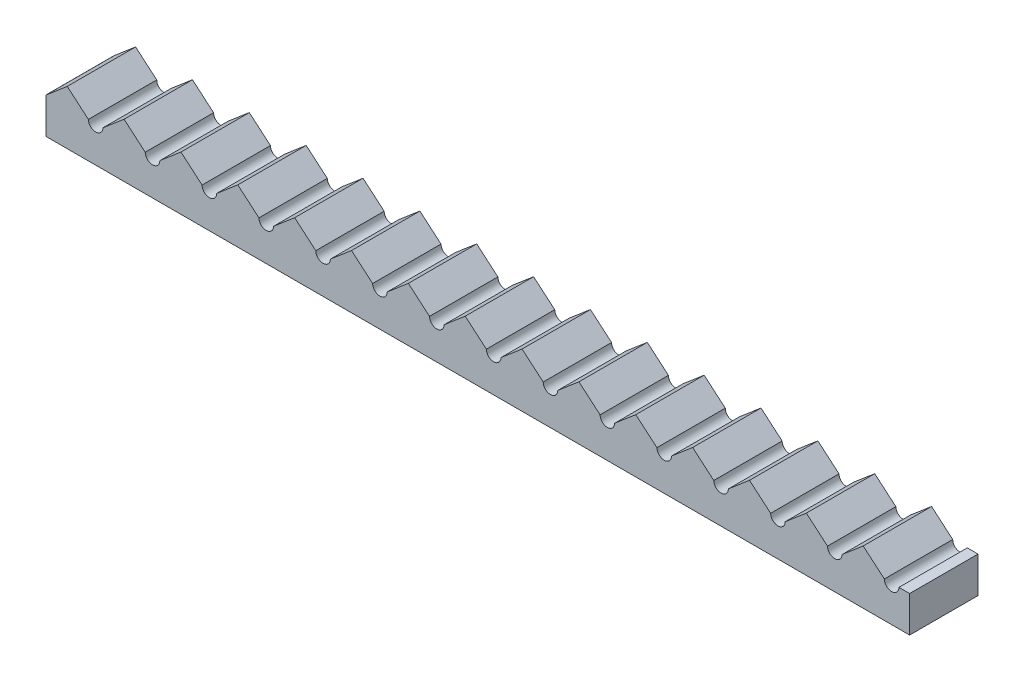
from build123d import *

# Parameters (mm, degrees)
SKETCH1_W           = 304.8
SKETCH1_H           = 12.7
BOSS_EXTRUDE1_DEPTH = 24.13
SKETCH3_R           = 2.57175
CUT_EXTRUDE1_DEPTH  = 39.624
BOSS_EXTRUDE2_DEPTH = 24.13


with BuildPart() as part:
    # Sketch1 → Boss-Extrude1 (new body)
    with BuildSketch(Plane.XY):
        with Locations((-152.4, -6.35)):
            Rectangle(SKETCH1_W, SKETCH1_H)
    extrude(amount=BOSS_EXTRUDE1_DEPTH)

    # Sketch3 → Cut-Extrude1 (cut)
    with BuildSketch(Plane.XY.offset(24.13)):
        with Locations((-26.416, 0)):
            Circle(SKETCH3_R)
        with Locations((-46.482, 0)):
            Circle(SKETCH3_R)
        with Locations((-66.548, 0)):
            Circle(SKETCH3_R)
        with Locations((-86.614, 0)):
            Circle(SKETCH3_R)
        with Locations((-106.68, 0)):
            Circle(SKETCH3_R)
        with Locations((-126.746, 0)):
            Circle(SKETCH3_R)
        with Locations((-146.812, 0)):
            Circle(SKETCH3_R)
        with Locations((-166.878, 0)):
            Circle(SKETCH3_R)
        with Locations((-186.944, 0)):
            Circle(SKETCH3_R)
        with Locations((-6.35, 0)):
            Circle(SKETCH3_R)
        with Locations((-207.01, 0)):
            Circle(SKETCH3_R)
        with Locations((-227.076, 0)):
            Circle(SKETCH3_R)
        with Locations((-247.142, 0)):
            Circle(SKETCH3_R)
        with Locations((-267.208, 0)):
            Circle(SKETCH3_R)
        with Locations((-287.274, 0)):
            Circle(SKETCH3_R)
    extrude(amount=-CUT_EXTRUDE1_DEPTH, mode=Mode.SUBTRACT)

    # Sketch4 → Boss-Extrude2 (add)
    with BuildSketch(Plane(origin=(0, 0, 0), x_dir=(-1, 0, 0), z_dir=(0, 0, -1))):
        Polygon((16.383, 6.35), (8.92175, 0), (23.84425, 0), align=None)
        Polygon((36.449, 6.35), (28.98775, 0), (43.91025, 0), align=None)
        Polygon((63.97625, 0), (56.515, 6.35), (49.05375, 0), align=None)
        Polygon((84.04225, 0), (76.581, 6.35), (69.11975, 0), align=None)
        Polygon((104.10825, 0), (96.647, 6.35), (89.18575, 0), align=None)
        Polygon((124.17425, 0), (116.713, 6.35), (109.25175, 0), align=None)
        Polygon((144.24025, 0), (136.779, 6.35), (129.31775, 0), align=None)
        Polygon((164.30625, 0), (156.845, 6.35), (149.38375, 0), align=None)
        Polygon((184.37225, 0), (176.911, 6.35), (169.44975, 0), align=None)
        Polygon((204.43825, 0), (196.977, 6.35), (189.51575, 0), align=None)
        Polygon((224.50425, 0), (217.043, 6.35), (209.58175, 0), align=None)
        Polygon((244.57025, 0), (237.109, 6.35), (229.64775, 0), align=None)
        Polygon((264.63625, 0), (257.175, 6.35), (249.71375, 0), align=None)
        Polygon((284.70225, 0), (277.241, 6.35), (269.77975, 0), align=None)
        Polygon((304.76825, 0), (297.307, 6.35), (289.84575, 0), align=None)
    extrude(amount=-BOSS_EXTRUDE2_DEPTH)


solid = part.part
